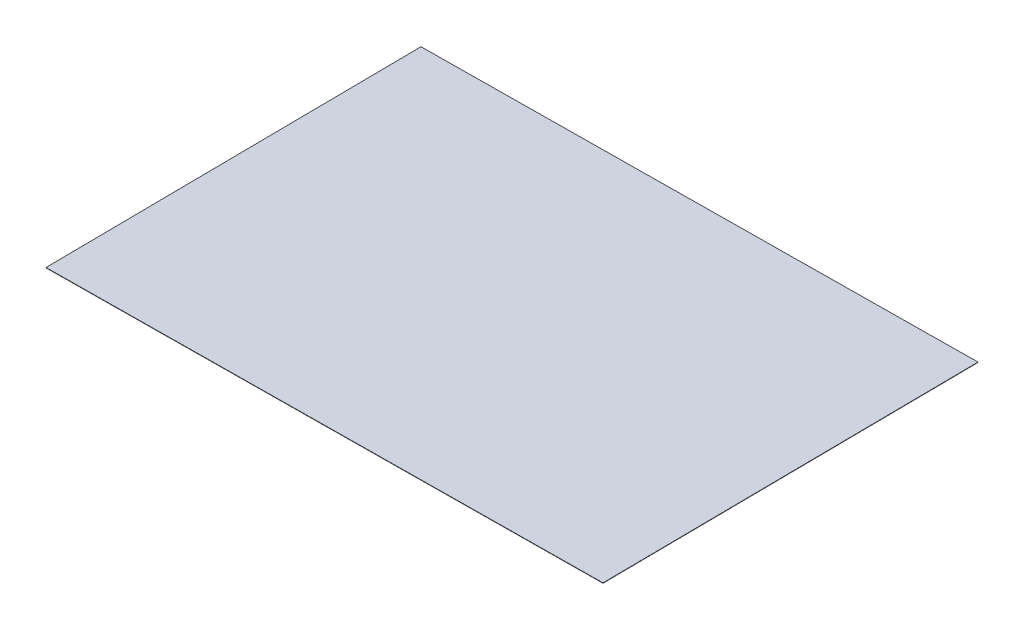
from build123d import *

# Parameters (mm, degrees)
SKETCH_1_W          = 17
SKETCH_1_H          = 12
EXTRUDE_1_DEPTH     = 0.01
SKETCH_2_W          = 23.426921432
SKETCH_2_H          = 16.11755769
CUT_EXTRUDE_1_DEPTH = 0.01
CUT_EXTRUDE_2_DEPTH = 0.01


with BuildPart() as part:
    # Эскиз1 → Бобышка-Вытянуть1 (new body)
    with BuildSketch(Plane(origin=(0, 0, 0), x_dir=(1, 0, 0), z_dir=(0, 1, 0))):
        Rectangle(SKETCH_1_W, SKETCH_1_H)
    extrude(amount=EXTRUDE_1_DEPTH)

    # Эскиз2 → Вырез-Вытянуть1 (cut)
    with BuildSketch(Plane(origin=(0, 0.01, 0), x_dir=(1, 0, 0), z_dir=(0, 1, 0))):
        Rectangle(SKETCH_2_W, SKETCH_2_H)
        Polygon((-7.738482856, 5.127895165), (7.639585466, 5.278414594), (7.742245069, -5.209974858), (-7.635823253, -5.360494287), align=None, mode=Mode.SUBTRACT)
    extrude(amount=-CUT_EXTRUDE_1_DEPTH, mode=Mode.SUBTRACT)

    # Эскиз3 → Вырез-Вытянуть2 (cut)
    with BuildSketch(Plane(origin=(0, 0.01, 0), x_dir=(1, 0, 0), z_dir=(0, 1, 0))):
        Polygon((7.639585466, 5.278414594), (7.742245069, -5.209974858), (7.642245069, -5.210953651), (7.539585466, 5.277435801), align=None)
    extrude(amount=-CUT_EXTRUDE_2_DEPTH, mode=Mode.SUBTRACT)


solid = part.part
